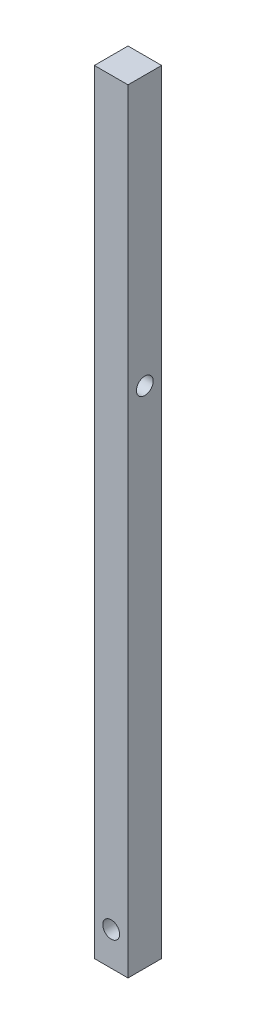
from build123d import *

# Parameters (mm, degrees)
SKETCH1_W           = 10
SKETCH1_H           = 10
BOSS_EXTRUDE1_DEPTH = 300
SKETCH3_R           = 2.5
CUT_EXTRUDE1_DEPTH  = 301.208261046
SKETCH4_W           = 10
SKETCH4_H           = 10
CUT_EXTRUDE2_DEPTH  = 70
SKETCH5_R           = 2.5
CUT_EXTRUDE3_DEPTH  = 231.271578793


with BuildPart() as part:
    # Sketch1 → Boss-Extrude1 (new body)
    with BuildSketch(Plane(origin=(0, 0, 0), x_dir=(1, 0, 0), z_dir=(0, 1, 0))):
        Rectangle(SKETCH1_W, SKETCH1_H)
    extrude(amount=BOSS_EXTRUDE1_DEPTH)

    # Sketch3 → Cut-Extrude1 (cut, through all)
    with BuildSketch(Plane.ZY.offset(5)):
        with Locations((0, 150)):
            Circle(SKETCH3_R)
    extrude(amount=-CUT_EXTRUDE1_DEPTH, mode=Mode.SUBTRACT)

    # Sketch4 → Cut-Extrude2 (cut)
    with BuildSketch(Plane(origin=(0, 300, 0), x_dir=(1, 0, 0), z_dir=(0, 1, 0))):
        Rectangle(SKETCH4_W, SKETCH4_H)
    extrude(amount=-CUT_EXTRUDE2_DEPTH, mode=Mode.SUBTRACT)

    # Sketch5 → Cut-Extrude3 (cut, through all)
    with BuildSketch(Plane(origin=(0, 0, -5), x_dir=(-1, 0, 0), z_dir=(0, 0, -1))):
        with Locations((0, 10)):
            Circle(SKETCH5_R)
    extrude(amount=-CUT_EXTRUDE3_DEPTH, mode=Mode.SUBTRACT)


solid = part.part
